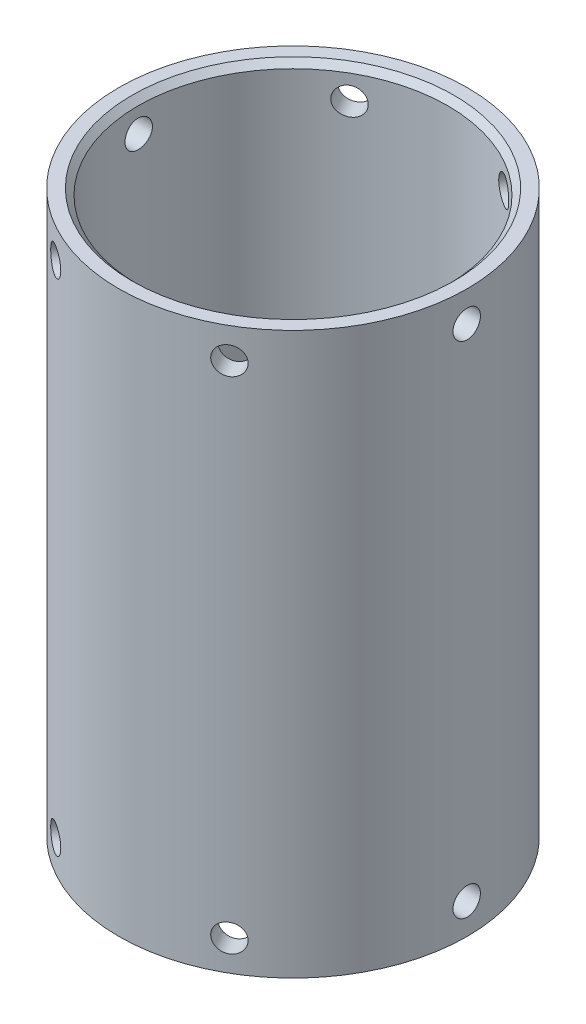
from build123d import *

# Parameters (mm, degrees)
SKETCH2_R           = 28.575
BOSS_EXTRUDE1_DEPTH = 92
SKETCH3_R           = 25.4
CUT_EXTRUDE1_DEPTH  = 110
SKETCH7_R           = 2.25
CUT_EXTRUDE2_DEPTH  = 110
CIRPATTERN1_COUNT   = 6
SKETCH8_R           = 2.25
CUT_EXTRUDE5_DEPTH  = 101.484134476
CIRPATTERN2_COUNT   = 6
CHAMFER1_SIZE       = 1


with BuildPart() as part:
    # Sketch2 → Boss-Extrude1 (new body)
    with BuildSketch(Plane(origin=(0, 0, 0), x_dir=(1, 0, 0), z_dir=(0, 1, 0))):
        with Locations(Location((0, 0, 0), (0, 0, 270))):
            Circle(SKETCH2_R)
    extrude(amount=-BOSS_EXTRUDE1_DEPTH)

    # Sketch3 → Cut-Extrude1 (cut)
    with BuildSketch(Plane(origin=(0, 0, 0), x_dir=(1, 0, 0), z_dir=(0, 1, 0))):
        with Locations(Location((0, 0, 0), (0, 0, 270))):
            Circle(SKETCH3_R)
    extrude(amount=-CUT_EXTRUDE1_DEPTH, mode=Mode.SUBTRACT)

    # Sketch7 → Cut-Extrude2 (cut)
    with BuildSketch(Plane(origin=(0, 0, 0), x_dir=(0, 0, -1), z_dir=(1, 0, 0))):
        with Locations((0, -5)):
            Circle(SKETCH7_R)
    cut_extrude2 = extrude(amount=-CUT_EXTRUDE2_DEPTH, mode=Mode.SUBTRACT)

    # CirPattern1: Cut-Extrude2 ×6 about axis
    cirpattern1_axis = Axis((0, 0, 0), (0, -1, 0))
    for i in range(1, CIRPATTERN1_COUNT):
        add(cut_extrude2.rotate(cirpattern1_axis, i * 360 / CIRPATTERN1_COUNT), mode=Mode.SUBTRACT)

    # Sketch8 → Cut-Extrude5 (cut, symmetric)
    with BuildSketch(Plane(origin=(0, 0, 0), x_dir=(0, 0, -1), z_dir=(1, 0, 0))):
        with Locations((0, -87)):
            Circle(SKETCH8_R)
    cut_extrude5 = extrude(amount=CUT_EXTRUDE5_DEPTH, both=True, mode=Mode.SUBTRACT)

    # CirPattern2: Cut-Extrude5 ×6 about axis
    cirpattern2_axis = Axis((0, 0, 0), (0, -1, 0))
    for i in range(1, CIRPATTERN2_COUNT):
        add(cut_extrude5.rotate(cirpattern2_axis, i * 360 / CIRPATTERN2_COUNT), mode=Mode.SUBTRACT)

    # Chamfer1
    chamfer1_edges = [part.edges().sort_by_distance(p)[0] for p in [
        (0, -92, -25.4),
        (0, 0, -25.4),
    ]]
    chamfer(chamfer1_edges, length=CHAMFER1_SIZE)


solid = part.part
